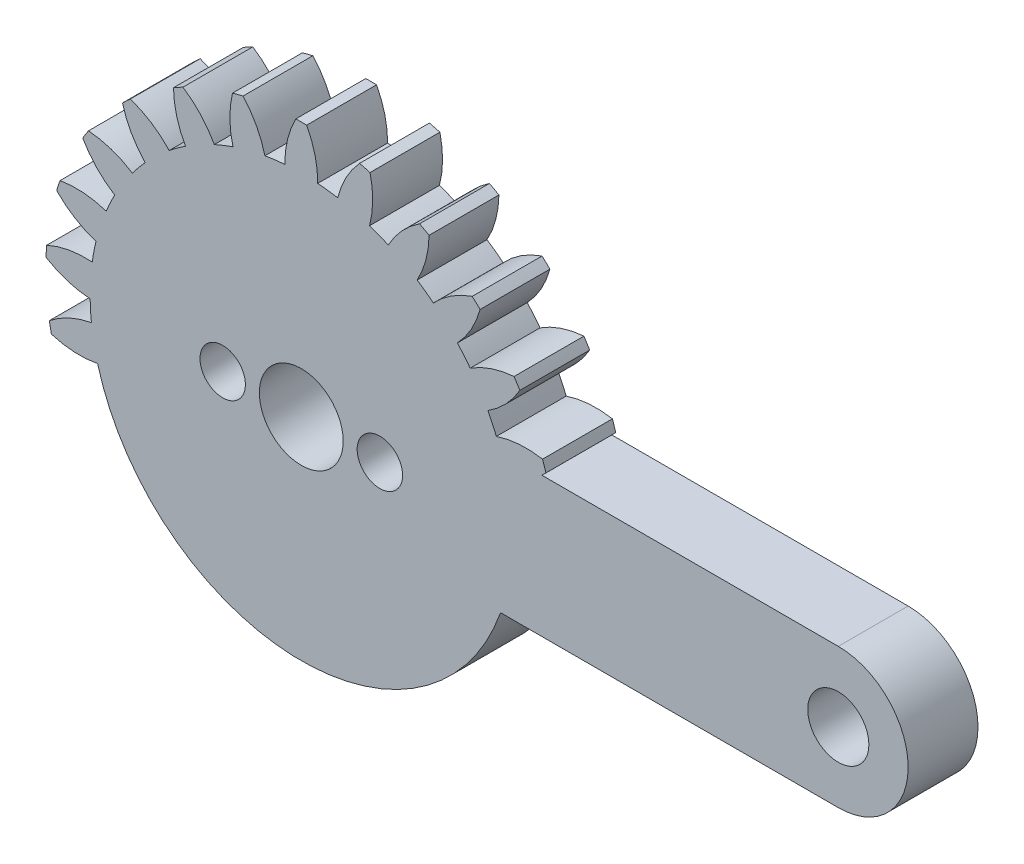
from build123d import *

# Parameters (mm, degrees)
SKETCH1_R           = 1.75
BOSS_EXTRUDE1_DEPTH = 4
SKETCH2_R           = 1.3
SKETCH2_R_2         = 2.4
CUT_EXTRUDE1_DEPTH  = 20


with BuildPart() as part:
    # Sketch1 → Boss-Extrude1 (new body)
    with BuildSketch(Plane.XY):
        with BuildLine():
            ThreePointArc((13.776114953, 4), (13.893050478, 4.110818553), (14.006628151, 4.225076075))
            ThreePointArc((14.006628151, 4.225076075), (13.913956833, 4.520918628), (13.815037615, 4.814731115))
            ThreePointArc((13.815037615, 4.814731115), (12.481386111, 4.882828881), (11.171803009, 4.621570895))
            ThreePointArc((11.171803009, 4.621570895), (10.939359064, 5.147671635), (10.682156823, 5.662122005))
            ThreePointArc((10.682156823, 5.662122005), (11.718219248, 6.50464102), (12.515850479, 7.575644315))
            ThreePointArc((12.515850479, 7.575644315), (12.35251755, 7.839146011), (12.183637866, 8.099127629))
            ThreePointArc((12.183637866, 8.099127629), (10.874950252, 7.833420336), (9.671482329, 7.254690176))
            ThreePointArc((9.671482329, 7.254690176), (9.315505105, 7.706456036), (8.938444741, 8.140780406))
            ThreePointArc((8.938444741, 8.140780406), (9.7324314, 9.214488384), (10.238655891, 10.450206961))
            ThreePointArc((10.238655891, 10.450206961), (10.01492416, 10.664811019), (9.786695342, 10.874626167))
            ThreePointArc((9.786695342, 10.874626167), (8.585201272, 10.291809183), (7.563466846, 9.431970593))
            ThreePointArc((7.563466846, 9.431970593), (7.1063237, 9.781015462), (6.633097302, 10.107923633))
            ThreePointArc((6.633097302, 10.107923633), (7.135119095, 11.345355554), (7.318128899, 12.668144672))
            ThreePointArc((7.318128899, 12.668144672), (7.048056252, 12.820366729), (6.774818757, 12.966831949))
            ThreePointArc((6.774818757, 12.966831949), (5.756012523, 12.103525808), (4.980210924, 11.016605609))
            ThreePointArc((4.980210924, 11.016605609), (4.450625842, 11.240997714), (3.910967965, 11.439948845))
            ThreePointArc((3.910967965, 11.439948845), (4.089481015, 12.763352309), (3.937776954, 14.090096262))
            ThreePointArc((3.937776954, 14.090096262), (3.638333049, 14.170371647), (3.337255394, 14.244283992))
            ThreePointArc((3.337255394, 14.244283992), (2.565152337, 13.154733392), (2.084030034, 11.909026779))
            ThreePointArc((2.084030034, 11.909026779), (1.515278794, 11.994666739), (0.943098128, 12.053159997))
            ThreePointArc((0.943098128, 12.053159997), (0.786885803, 13.379380698), (0.31, 14.626715284))
            ThreePointArc((0.31, 14.626715284), (0, 14.63), (-0.31, 14.626715284))
            ThreePointArc((-0.31, 14.626715284), (-0.786885803, 13.379380698), (-0.943098128, 12.053159997))
            ThreePointArc((-0.943098128, 12.053159997), (-1.515278794, 11.994666739), (-2.084030034, 11.909026779))
            ThreePointArc((-2.084030034, 11.909026779), (-2.565152337, 13.154733392), (-3.337255394, 14.244283992))
            ThreePointArc((-3.337255394, 14.244283992), (-3.638333049, 14.170371647), (-3.937776954, 14.090096262))
            ThreePointArc((-3.937776954, 14.090096262), (-4.089481015, 12.763352309), (-3.910967965, 11.439948845))
            ThreePointArc((-3.910967965, 11.439948845), (-4.450625842, 11.240997714), (-4.980210924, 11.016605609))
            ThreePointArc((-4.980210924, 11.016605609), (-5.756012523, 12.103525808), (-6.774818757, 12.966831949))
            ThreePointArc((-6.774818757, 12.966831949), (-7.048056252, 12.820366729), (-7.318128899, 12.668144672))
            ThreePointArc((-7.318128899, 12.668144672), (-7.135119095, 11.345355554), (-6.633097302, 10.107923633))
            ThreePointArc((-6.633097302, 10.107923633), (-7.1063237, 9.781015462), (-7.563466846, 9.431970593))
            ThreePointArc((-7.563466846, 9.431970593), (-8.585201272, 10.291809183), (-9.786695342, 10.874626167))
            ThreePointArc((-9.786695342, 10.874626167), (-10.01492416, 10.664811019), (-10.238655891, 10.450206961))
            ThreePointArc((-10.238655891, 10.450206961), (-9.7324314, 9.214488384), (-8.938444741, 8.140780406))
            ThreePointArc((-8.938444741, 8.140780406), (-9.315505105, 7.706456036), (-9.671482329, 7.254690176))
            ThreePointArc((-9.671482329, 7.254690176), (-10.874950252, 7.833420336), (-12.183637866, 8.099127629))
            ThreePointArc((-12.183637866, 8.099127629), (-12.35251755, 7.839146011), (-12.515850479, 7.575644315))
            ThreePointArc((-12.515850479, 7.575644315), (-11.718219248, 6.50464102), (-10.682156823, 5.662122005))
            ThreePointArc((-10.682156823, 5.662122005), (-10.939359064, 5.147671635), (-11.171803009, 4.621570895))
            ThreePointArc((-11.171803009, 4.621570895), (-12.481386111, 4.882828881), (-13.815037615, 4.814731115))
            ThreePointArc((-13.815037615, 4.814731115), (-13.913956833, 4.520918628), (-14.006628151, 4.225076075))
            ThreePointArc((-14.006628151, 4.225076075), (-12.967708283, 3.386083139), (-11.754669706, 2.827691655))
            ThreePointArc((-11.754669706, 2.827691655), (-11.875852861, 2.265440093), (-11.970158218, 1.698061317))
            ThreePointArc((-11.970158218, 1.698061317), (-13.303570578, 1.625431329), (-14.578387742, 1.227807338))
            ThreePointArc((-14.578387742, 1.227807338), (-14.601131037, 0.918625301), (-14.617317864, 0.609030766))
            ThreePointArc((-14.617317864, 0.609030766), (-13.402388515, 0.054765201), (-12.088593461, -0.184412961))
            ThreePointArc((-12.088593461, -0.184412961), (-12.066143147, -0.759137381), (-12.016384363, -1.332143698))
            ThreePointArc((-12.016384363, -1.332143698), (-13.289842779, -1.734098051), (-14.425724151, -2.43626409))
            ThreePointArc((-14.425724151, -2.43626409), (-14.370862478, -2.741388632), (-14.309547736, -3.045282186))
            ThreePointArc((-14.309547736, -3.045282186), (-12.994947386, -3.279993836), (-11.662946429, -3.184930232))
            ThreePointArc((-11.662946429, -3.184930232), (-0.426838607, -12.082462862), (11.409123542, -4))
            Line((11.409123542, -4), (30.75, -4))
            ThreePointArc((30.75, -4), (34.75, 0), (30.75, 4))
            Line((30.75, 4), (13.776114953, 4))
        make_face()
        Circle(SKETCH1_R, mode=Mode.SUBTRACT)
        with Locations((30.75, 0)):
            Circle(SKETCH1_R, mode=Mode.SUBTRACT)
    extrude(amount=BOSS_EXTRUDE1_DEPTH)

    # Sketch2 → Cut-Extrude1 (cut)
    with BuildSketch(Plane.XY.offset(4)):
        with Locations((4.5, 0)):
            Circle(SKETCH2_R)
        with Locations((-4.5, 0)):
            Circle(SKETCH2_R)
        Circle(SKETCH2_R_2)
    extrude(amount=-CUT_EXTRUDE1_DEPTH, mode=Mode.SUBTRACT)


solid = part.part
